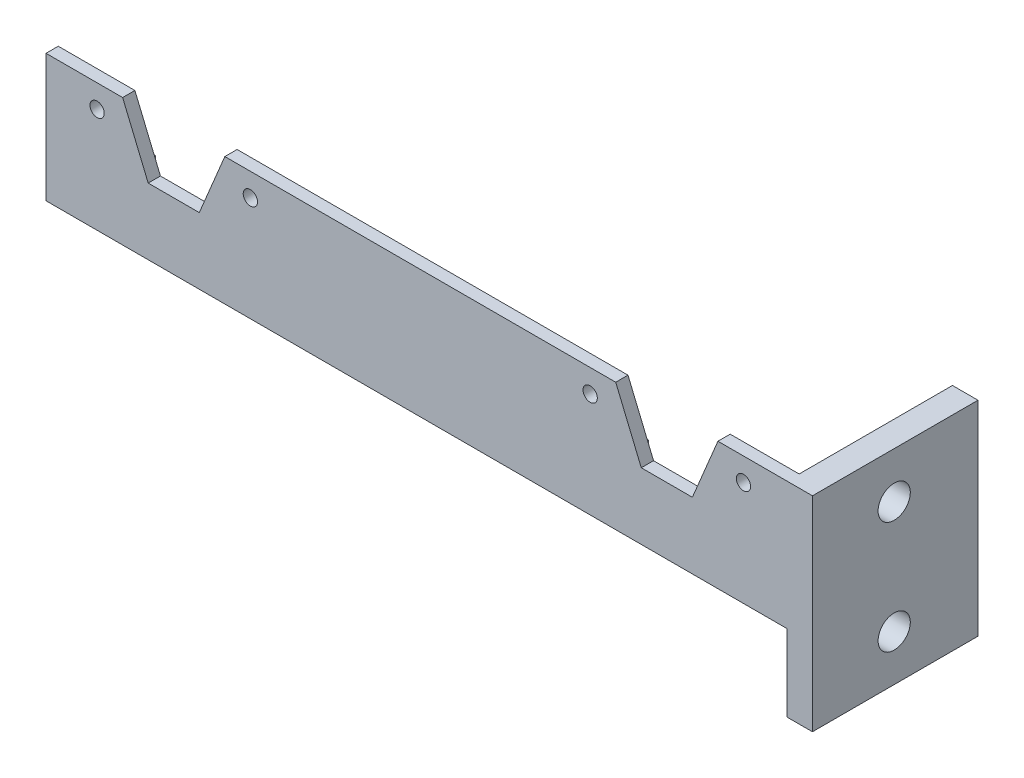
from build123d import *

# Parameters (mm, degrees)
SKETCH1_W                       = 150
SKETCH1_H                       = 25
BOSS_EXTRUDE1_DEPTH             = 2.4
SKETCH2_R                       = 1.4
CUT_EXTRUDE1_DEPTH              = 153.088000842
SKETCH3_W                       = 5
SKETCH3_H                       = 40
BOSS_EXTRUDE2_DEPTH             = 30
BOSS_EXTRUDE2_DIRECTION_2_REACH = 154.088
SKETCH4_R                       = 3.15
CUT_EXTRUDE2_DEPTH              = 30
SKETCH8_W                       = 10
SKETCH8_H                       = 2
BOSS_EXTRUDE4_DEPTH             = 145
SKETCH9_W                       = 20
SKETCH9_H                       = 12.540874848
SKETCH9_H_2                     = 13.006860614
CUT_EXTRUDE4_DEPTH              = 159.113883008
CHAMFER5_SIZE                   = 6


with BuildPart() as part:
    # Sketch1 → Boss-Extrude1 (new body)
    with BuildSketch(Plane.XY):
        with Locations((75, 12.5)):
            Rectangle(SKETCH1_W, SKETCH1_H)
    extrude(amount=BOSS_EXTRUDE1_DEPTH)

    # Sketch2 → Cut-Extrude1 (cut, through all)
    with BuildSketch(Plane.XY.offset(2.4)):
        with Locations((40, 20.5)):
            Circle(SKETCH2_R)
        with Locations(Location((10, 20.5, 0), (0, 0, 180))):
            Circle(SKETCH2_R)
        with Locations(Location((106.5, 20.5, 0), (0, 0, 180))):
            Circle(SKETCH2_R)
        with Locations((136.5, 20.5)):
            Circle(SKETCH2_R)
        Polygon((131.5, 25), (126.5, 13), (116.5, 13), (111.5, 25), align=None)
        Polygon((35, 25), (30, 13), (20, 13), (15, 25), align=None)
    extrude(amount=-CUT_EXTRUDE1_DEPTH, mode=Mode.SUBTRACT)

    # Sketch3 → Boss-Extrude2 (add)
    with BuildSketch(Plane(origin=(0, 0, 0), x_dir=(-1, 0, 0), z_dir=(0, 0, -1))):
        with Locations((-147.5, 5)):
            Rectangle(SKETCH3_W, SKETCH3_H)
    extrude(amount=BOSS_EXTRUDE2_DEPTH)

    # Boss-Extrude2 direction 2: up to this face of the body (flat: up to its plane)
    boss_extrude2_direction_2_end = Plane(part.part.faces().sort_by_distance((75.200008519, 11.67481859, 2.4))[0])
    # Sketch3 → Boss-Extrude2 direction 2 (add, up to the picked face)
    with BuildSketch(Plane(origin=(0, 0, 0), x_dir=(-1, 0, 0), z_dir=(0, 0, -1)), mode=Mode.PRIVATE) as boss_extrude2_direction_2_sk1:
        with Locations((-147.5, 5)):
            Rectangle(SKETCH3_W, SKETCH3_H)
    boss_extrude2_direction_2_tool1 = split(extrude(boss_extrude2_direction_2_sk1.sketch, amount=-BOSS_EXTRUDE2_DIRECTION_2_REACH, mode=Mode.PRIVATE), bisect_by=boss_extrude2_direction_2_end, keep=Keep.BOTH, mode=Mode.PRIVATE)
    add(boss_extrude2_direction_2_tool1.solids().sort_by(Axis((147.5, 5, 0), (0, 0, 1)))[0])

    # Sketch4 → Cut-Extrude2 (cut)
    with BuildSketch(Plane.ZY.offset(-145)):
        with Locations((-13.6, 16)):
            Circle(SKETCH4_R)
        with Locations((-13.6, -6)):
            Circle(SKETCH4_R)
    extrude(amount=-CUT_EXTRUDE2_DEPTH, mode=Mode.SUBTRACT)

    # Sketch8 → Boss-Extrude4 (add)
    with BuildSketch(Plane.ZY.offset(-145)):
        with Locations((-5, 5)):
            Rectangle(SKETCH8_W, SKETCH8_H)
    extrude(amount=BOSS_EXTRUDE4_DEPTH)

    # Sketch9 → Cut-Extrude4 (cut, through all)
    with BuildSketch(Plane(origin=(0, 25, 0), x_dir=(1, 0, 0), z_dir=(0, 1, 0))):
        with Locations((121.5, 6.270437424)):
            Rectangle(SKETCH9_W, SKETCH9_H)
        with Locations((25, 6.503430307)):
            Rectangle(SKETCH9_W, SKETCH9_H_2)
    extrude(amount=-CUT_EXTRUDE4_DEPTH, mode=Mode.SUBTRACT)

    # Chamfer5
    chamfer5_edges = [part.edges().sort_by_distance(p)[0] for p in [
        (111.5, 5, -10),
        (131.5, 5, -10),
        (15, 5, -10),
        (35, 5, -10),
        (0, 5, -10),
    ]]
    chamfer(chamfer5_edges, length=CHAMFER5_SIZE)


solid = part.part
